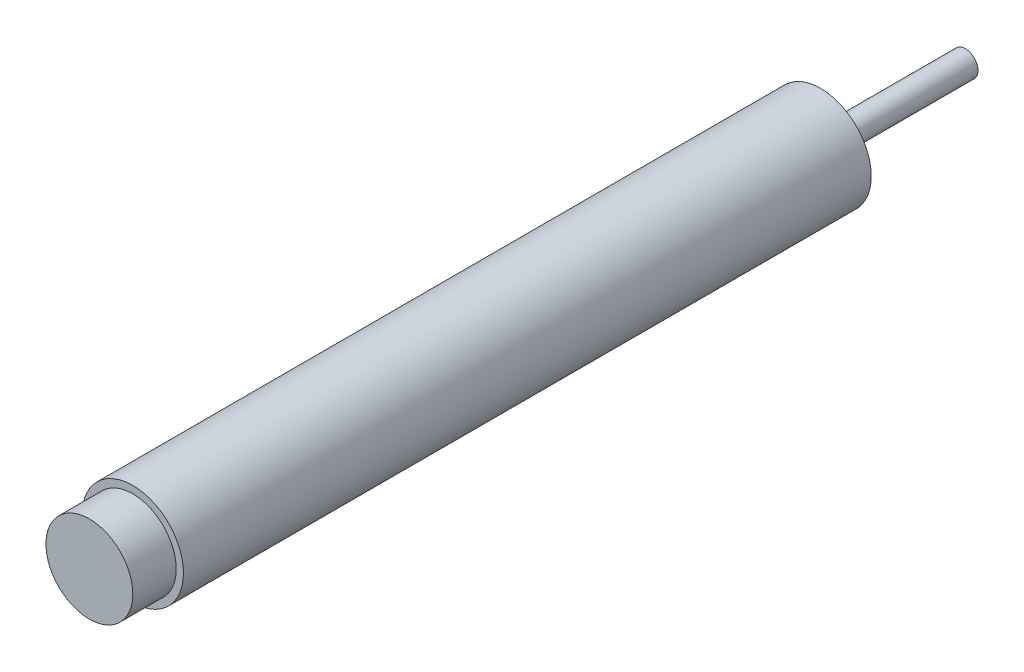
from build123d import *

# Parameters (mm, degrees)
SKETCH_1_R      = 7
EXTRUDE_1_DEPTH = 95
SKETCH_2_R      = 1.75
EXTRUDE_2_DEPTH = 20
SKETCH_3_R      = 6
EXTRUDE_3_DEPTH = 6


with BuildPart() as part:
    # 草图1 → 拉伸1 (new body)
    with BuildSketch(Plane.XY):
        Circle(SKETCH_1_R)
    extrude(amount=EXTRUDE_1_DEPTH)

    # 草图2 → 拉伸2 (add)
    with BuildSketch(Plane(origin=(0, 0, 0), x_dir=(-1, 0, 0), z_dir=(0, 0, -1))):
        with Locations(Location((0, 0, 0), (0, 0, 180))):
            Circle(SKETCH_2_R)
    extrude(amount=EXTRUDE_2_DEPTH)

    # 草图3 → 拉伸3 (add)
    with BuildSketch(Plane.XY.offset(95)):
        Circle(SKETCH_3_R)
    extrude(amount=EXTRUDE_3_DEPTH)


solid = part.part
